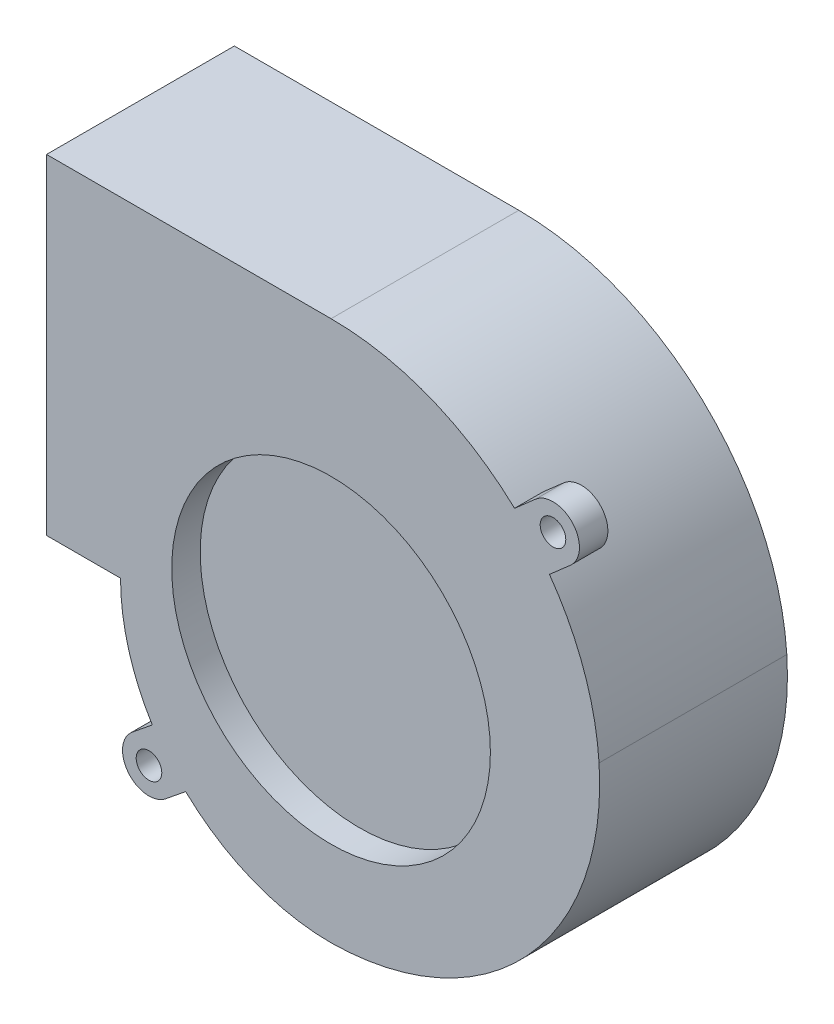
from build123d import *
from build123d.topology import SkipClean

# Parameters (mm, degrees)
SKETCH2_R           = 2.25
SKETCH2_R_2         = 28
BOSS_EXTRUDE1_DEPTH = 5
SKETCH5_R           = 28
BOSS_EXTRUDE3_DEPTH = 28
SKETCH6_W           = 30
SKETCH6_H           = 55
CUT_EXTRUDE1_DEPTH  = 20


with BuildPart() as part:
    # Sketch2 → Boss-Extrude1 (new body)
    # profile 1 of 3: a face of its own
    with BuildSketch(Plane.XY):
        with BuildLine():
            Line((35.933927487, 42.495954711), (32.250401879, 39.26537607))
            ThreePointArc((32.250401879, 39.26537607), (35.489083713, 35.92080567), (38.382546905, 32.273466648))
            Line((38.382546905, 32.273466648), (42.066072513, 35.504045289))
            ThreePointArc((42.066072513, 35.504045289), (42.495954711, 42.066072513), (35.933927487, 42.495954711))
        make_face()
        with Locations((39, 39)):
            Circle(SKETCH2_R, mode=Mode.SUBTRACT)
    # profile 2 of 3: a face of its own
    with BuildSketch(Plane.XY):
        with BuildLine():
            ThreePointArc((-25.556282339, -32.755867263), (-28.716218004, -29.331927128), (-31.420793753, -25.538007062))
            Line((-31.420793753, -25.538007062), (-34.932255707, -28.391069899))
            ThreePointArc((-34.932255707, -28.391069899), (-35.608930101, -34.932255707), (-29.067744293, -35.608930101))
            Line((-29.067744293, -35.608930101), (-25.556282339, -32.755867263))
        make_face()
        with Locations((-32, -32)):
            Circle(SKETCH2_R, mode=Mode.SUBTRACT)
    # profile 3 of 3: a face of its own
    with BuildSketch(Plane.XY):
        with BuildLine():
            ThreePointArc((0, -43), (-26.162950904, -32.162950904), (-37, -6))
            Line((-37, -6), (-50, -6))
            Line((-50, -6), (-50, 52))
            Line((-50, 52), (0, 52))
            ThreePointArc((0, 52), (32.250401879, 39.26537607), (47.1, 7.932509882))
            ThreePointArc((47.1, 7.932509882), (34.50998509, -27.669026021), (0, -43))
        make_face()
        Circle(SKETCH2_R_2, mode=Mode.SUBTRACT)
    extrude(amount=-BOSS_EXTRUDE1_DEPTH)

    # Sketch5 → Boss-Extrude3 (add)
    # profile 1 of 2: a face of its own
    with SkipClean():  # the faces are left unmerged after this step: merging them gives an invalid solid
        with BuildSketch(Plane.XY.offset(-5)):
            with BuildLine():
                ThreePointArc((32.250401879, 39.26537607), (17.336803829, 48.701069191), (0, 52))
                Line((0, 52), (-50, 52))
                Line((-50, 52), (-50, -6))
                Line((-50, -6), (-37, -6))
                ThreePointArc((-37, -6), (-35.577867902, -16.159493864), (-31.420793753, -25.538007062))
                ThreePointArc((-31.420793753, -25.538007062), (-28.716218004, -29.331927128), (-25.556282339, -32.755867263))
                ThreePointArc((-25.556282339, -32.755867263), (-13.766497581, -40.34360995), (0, -43))
                ThreePointArc((0, -43), (34.50998509, -27.669026021), (47.1, 7.932509882))
                ThreePointArc((47.1, 7.932509882), (44.44026328, 20.711463284), (38.382546905, 32.273466648))
                ThreePointArc((38.382546905, 32.273466648), (35.489083713, 35.92080567), (32.250401879, 39.26537607))
            make_face()
            Circle(SKETCH5_R, mode=Mode.SUBTRACT)
        # profile 2 of 2: a face of its own
        with BuildSketch(Plane.XY.offset(-5)):
            Circle(SKETCH5_R)
        extrude(amount=-BOSS_EXTRUDE3_DEPTH)

    # Sketch6 → Cut-Extrude1 (cut)
    with SkipClean():  # the faces are left unmerged after this step: merging them gives an invalid solid
        with BuildSketch(Plane.ZY.offset(50)):
            with Locations((-16.5, 23)):
                Rectangle(SKETCH6_W, SKETCH6_H)
        extrude(amount=-CUT_EXTRUDE1_DEPTH, mode=Mode.SUBTRACT)


solid = part.part
